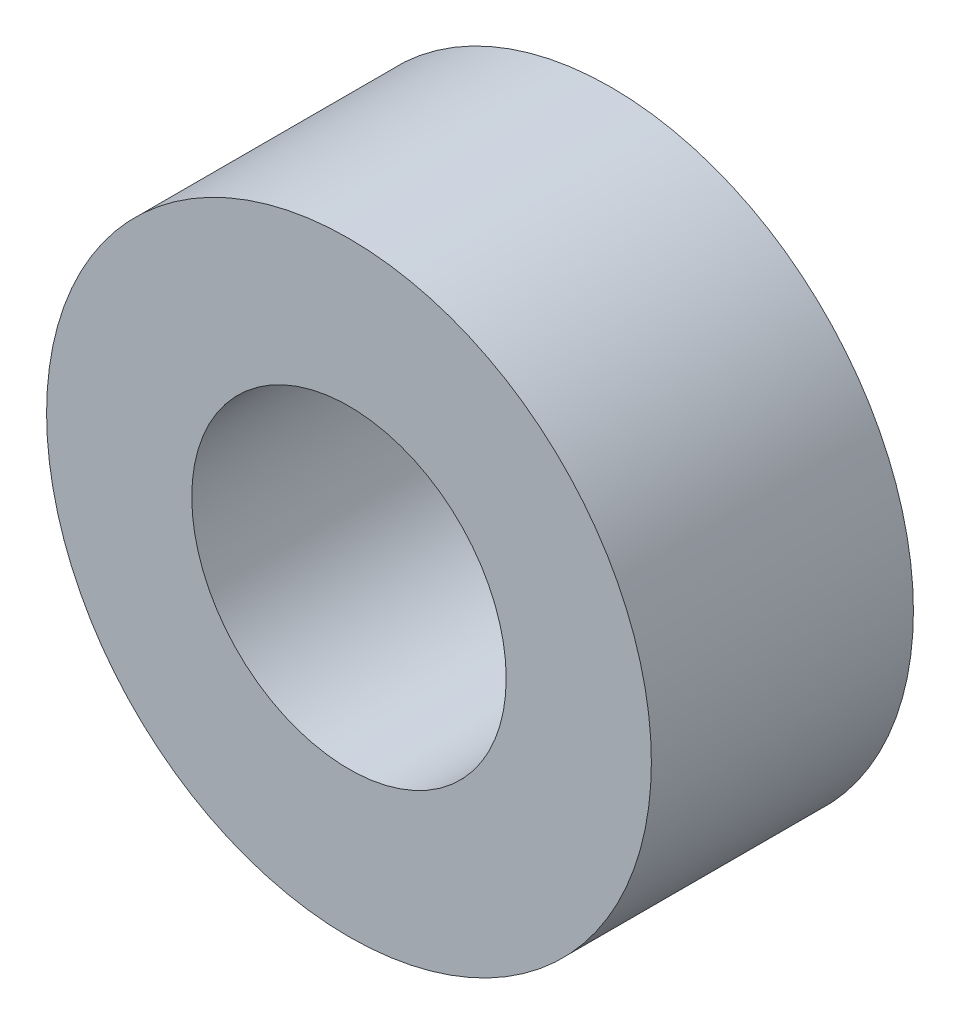
from build123d import *

# Parameters (mm, degrees)
SKETCH_1_R          = 5.77
EXTRUDE_1_DEPTH     = 5
SKETCH_2_R          = 3
CUT_EXTRUDE_1_DEPTH = 6


with BuildPart() as part:
    # 草图1 → 凸台-拉伸1 (new body)
    with BuildSketch(Plane.XY):
        Circle(SKETCH_1_R)
    extrude(amount=EXTRUDE_1_DEPTH)

    # 草图2 → 切除-拉伸1 (cut)
    with BuildSketch(Plane(origin=(0, 0, 0), x_dir=(-1, 0, 0), z_dir=(0, 0, -1))):
        Circle(SKETCH_2_R)
    extrude(amount=-CUT_EXTRUDE_1_DEPTH, mode=Mode.SUBTRACT)


solid = part.part
